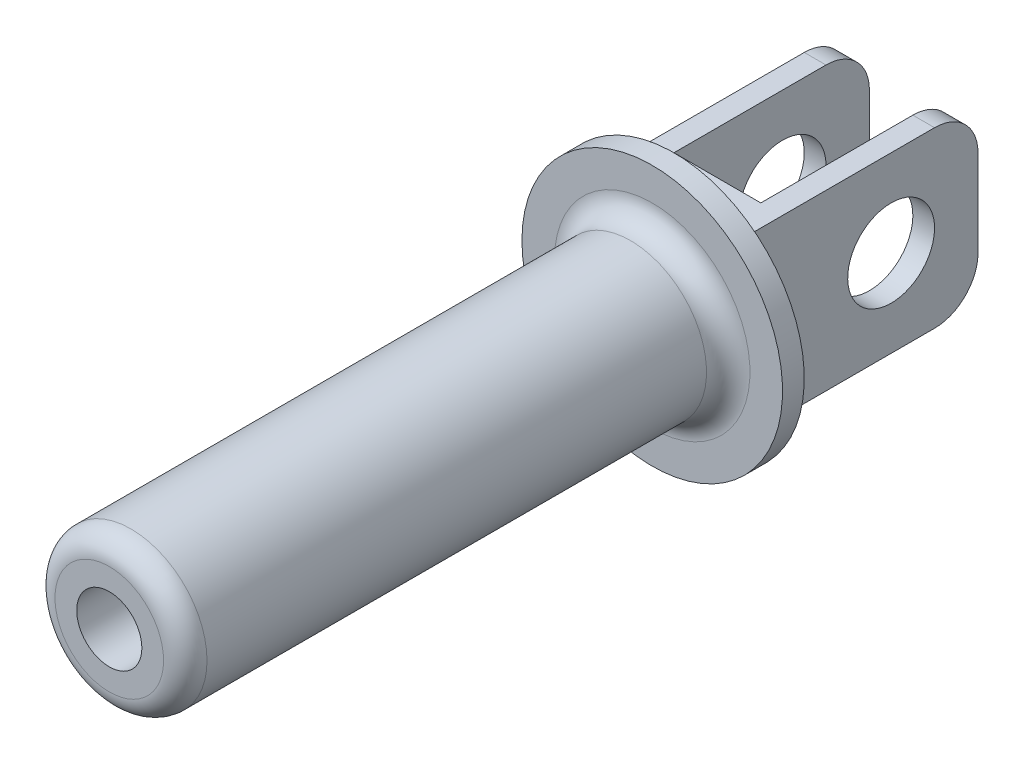
from build123d import *

# Parameters (mm, degrees)
SKETCH_1_R               = 17.5
EXTRUDE_1_DEPTH          = 125
SKETCH_2_R               = 30
EXTRUDE_2_DEPTH          = 5
SKETCH_4_W               = 30
SKETCH_4_H               = 40
EXTRUDE_3_DEPTH          = 55
SKETCH_8_R               = 7.5
CUT_EXTRUDE_3_DEPTH      = 70
SKETCH_9_W               = 20
SKETCH_9_H               = 40
CUT_EXTRUDE_4_DEPTH      = 45
CUT_EXTRUDE_5_DEPTH      = 137.198384719
CUT_EXTRUDE_5_DEPTH_BACK = 137.198384719
SKETCH_7_R               = 10
FILLET_9_R               = 5
FILLET_10_R              = 5
FILLET_11_R              = 10
SCALE_1_SCALE            = 0.5


with BuildPart() as part:
    # 草图1 → 凸台-拉伸1 (new body)
    with BuildSketch(Plane.XY):
        Circle(SKETCH_1_R)
    extrude(amount=EXTRUDE_1_DEPTH)

    # 草图2 → 凸台-拉伸2 (add)
    with BuildSketch(Plane(origin=(0, 0, 0), x_dir=(-1, 0, 0), z_dir=(0, 0, -1))):
        Circle(SKETCH_2_R)
    extrude(amount=EXTRUDE_2_DEPTH)

    # 草图4 → 凸台-拉伸3 (add)
    with BuildSketch(Plane(origin=(0, 0, -5), x_dir=(-1, 0, 0), z_dir=(0, 0, -1))):
        Rectangle(SKETCH_4_W, SKETCH_4_H)
    extrude(amount=EXTRUDE_3_DEPTH)

    # 草图8 → 切除-拉伸3 (cut)
    with BuildSketch(Plane.XY.offset(125)):
        Circle(SKETCH_8_R)
    extrude(amount=-CUT_EXTRUDE_3_DEPTH, mode=Mode.SUBTRACT)

    # 草图9 → 切除-拉伸4 (cut)
    with BuildSketch(Plane(origin=(0, 0, -60), x_dir=(-1, 0, 0), z_dir=(0, 0, -1))):
        Rectangle(SKETCH_9_W, SKETCH_9_H)
    extrude(amount=-CUT_EXTRUDE_4_DEPTH, mode=Mode.SUBTRACT)

    # 草图7 → 切除-拉伸5 (cut, two sides: drawn at the far end of the back side and taken through both)
    with BuildSketch(Plane(origin=(15, 0, 0), x_dir=(0, 0, -1), z_dir=(1, 0, 0)).offset(-CUT_EXTRUDE_5_DEPTH_BACK)):
        with Locations(Location((40, 0, 0), (0, 0, 90))):
            Circle(SKETCH_7_R)
    extrude(amount=CUT_EXTRUDE_5_DEPTH + CUT_EXTRUDE_5_DEPTH_BACK, mode=Mode.SUBTRACT)

    # 圆角9
    fillet_9_edges = [part.edges().sort_by_distance(p)[0] for p in [
        (-17.5, 0, 0),
    ]]
    fillet(fillet_9_edges, radius=FILLET_9_R)

    # 圆角10
    fillet_10_edges = [part.edges().sort_by_distance(p)[0] for p in [
        (-17.5, 0, 125),
    ]]
    fillet(fillet_10_edges, radius=FILLET_10_R)

    # 圆角11
    fillet_11_edges = [part.edges().sort_by_distance(p)[0] for p in [
        (-12.5, 20, -60),
        (12.5, -20, -60),
        (12.5, 20, -60),
        (-12.5, -20, -60),
    ]]
    fillet(fillet_11_edges, radius=FILLET_11_R)


with BuildPart() as part_1:
    # 缩放比例1: scaled about (0, 0, 0)
    add(part.part.scale(SCALE_1_SCALE))


solid = part_1.part
